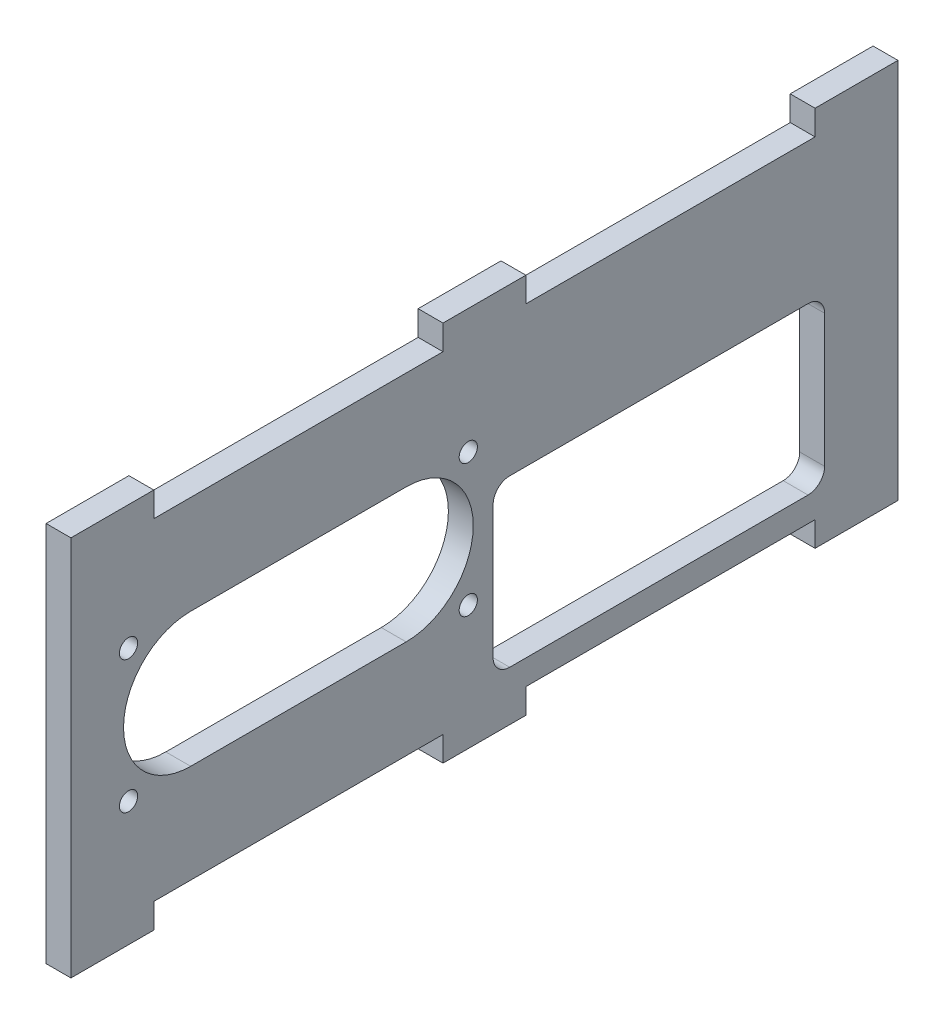
from build123d import *

# Parameters (mm, degrees)
SKETCH1_W           = 99.8
SKETCH1_H           = 40
SKETCH1_W_2         = 10
SKETCH1_H_2         = 3
BOSS_EXTRUDE1_DEPTH = 3
SKETCH2_R           = 1.1
CUT_EXTRUDE1_DEPTH  = 76.977118266
SKETCH3_W           = 40
SKETCH3_H           = 20
CUT_EXTRUDE2_DEPTH  = 76.977118266
FILLET1_R           = 2


with BuildPart() as part:
    # Sketch1 → Boss-Extrude1 (new body)
    with BuildSketch(Plane(origin=(0, 0, 0), x_dir=(0, 0, -1), z_dir=(1, 0, 0))):
        with Locations((22.45, 0)):
            Rectangle(SKETCH1_W, SKETCH1_H)
        with Locations((-22.45, 21.5)):
            Rectangle(SKETCH1_W_2, SKETCH1_H_2)
        with Locations((22.45, 21.5)):
            Rectangle(SKETCH1_W_2, SKETCH1_H_2)
        with Locations((67.35, 21.5)):
            Rectangle(SKETCH1_W_2, SKETCH1_H_2)
        with Locations((67.35, -21.5)):
            Rectangle(SKETCH1_W_2, SKETCH1_H_2)
        with Locations((22.45, -21.5)):
            Rectangle(SKETCH1_W_2, SKETCH1_H_2)
        with Locations((-22.45, -21.5)):
            Rectangle(SKETCH1_W_2, SKETCH1_H_2)
    extrude(amount=BOSS_EXTRUDE1_DEPTH)

    # Sketch2 → Cut-Extrude1 (cut, through all)
    with BuildSketch(Plane(origin=(3, 0, 0), x_dir=(0, 0, -1), z_dir=(1, 0, 0))):
        with Locations((-20.5, 8)):
            Circle(SKETCH2_R)
        with Locations((-20.5, -8)):
            Circle(SKETCH2_R)
        with Locations((20.5, 8)):
            Circle(SKETCH2_R)
        with Locations((20.5, -8)):
            Circle(SKETCH2_R)
        with BuildLine():
            Line((-13, 8.1), (13, 8.1))
            ThreePointArc((13, 8.1), (21.1, 0), (13, -8.1))
            Line((13, -8.1), (-13, -8.1))
            ThreePointArc((-13, -8.1), (-21.1, 0), (-13, 8.1))
        make_face()
    extrude(amount=-CUT_EXTRUDE1_DEPTH, mode=Mode.SUBTRACT)

    # Sketch3 → Cut-Extrude2 (cut, through all)
    with BuildSketch(Plane(origin=(3, 0, 0), x_dir=(0, 0, -1), z_dir=(1, 0, 0))):
        with Locations((43.5, -7)):
            Rectangle(SKETCH3_W, SKETCH3_H)
    extrude(amount=-CUT_EXTRUDE2_DEPTH, mode=Mode.SUBTRACT)

    # Fillet1
    fillet1_edges = [part.edges().sort_by_distance(p)[0] for p in [
        (1.5, -17, -23.5),
        (1.5, 3, -23.5),
        (1.5, 3, -63.5),
        (1.5, -17, -63.5),
    ]]
    fillet(fillet1_edges, radius=FILLET1_R)


solid = part.part
